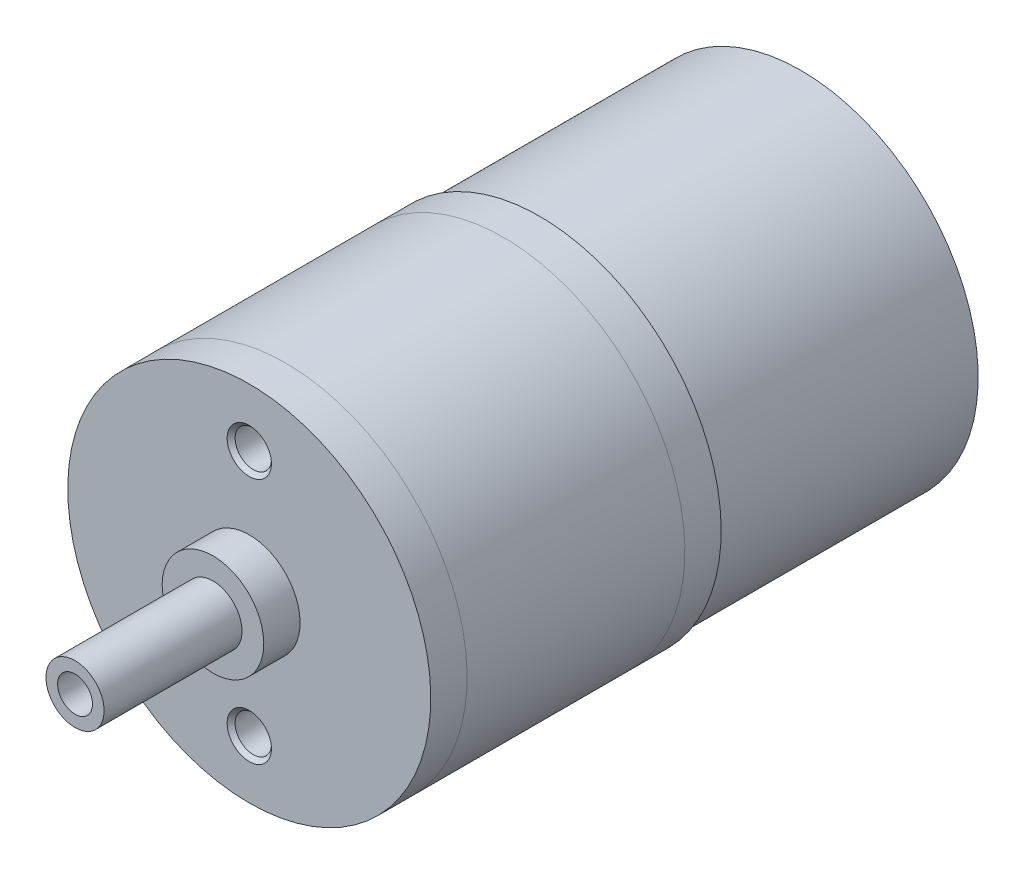
from build123d import *

# Parameters (mm, degrees)
M3X0_5_TAPPED_HOLE1_D           = 2.5
M3X0_5_TAPPED_HOLE1_DEPTH       = 6.248924226
M3X0_5_TAPPED_HOLE1_CSINK_D     = 3.05
M3X0_5_TAPPED_HOLE1_CSINK_ANGLE = 90
M3X0_5_TAPPED_HOLE1_TIP         = 0.751075774
FILLET1_R                       = 1


with BuildPart() as part:
    # Sketch1 → Revolve1 (revolve)
    with BuildSketch(Plane(origin=(0, 0, 0), x_dir=(0, 0, -1), z_dir=(1, 0, 0)), mode=Mode.PRIVATE) as revolve1_sk:
        Polygon((20, 0), (20, 3.5), (18, 3.5), (18, 12.2), (0, 12.2), (0, 12.5), (-20, 12.5), (-20, 3.5), (-22.5, 3.5), (-22.5, 2), (-32, 2), (-32, 1.2), (-24, 1.2), (-24, 0), align=None)
    revolve(revolve1_sk.sketch.rotate(Axis((0, 0, 0), (0, 0, -1)), 180), axis=Axis((0, 0, 0), (0, 0, -1)))

    # M3x0.5 Tapped Hole1
    with Locations(Plane.XY.offset(20)):
        with Locations((0, 8.5), (0, -8.5)):
            CounterSinkHole(M3X0_5_TAPPED_HOLE1_D / 2, M3X0_5_TAPPED_HOLE1_CSINK_D / 2, depth=M3X0_5_TAPPED_HOLE1_DEPTH, counter_sink_angle=M3X0_5_TAPPED_HOLE1_CSINK_ANGLE)
            with Locations((0, 0, -(M3X0_5_TAPPED_HOLE1_DEPTH + M3X0_5_TAPPED_HOLE1_TIP / 2))):  # 118° drill point
                Cone(0, M3X0_5_TAPPED_HOLE1_D / 2, M3X0_5_TAPPED_HOLE1_TIP, mode=Mode.SUBTRACT)

    # Fillet1
    fillet1_edges = [part.edges().sort_by_distance(p)[0] for p in [
        (0, 1.2, 24),
    ]]
    fillet(fillet1_edges, radius=FILLET1_R)


solid = part.part
